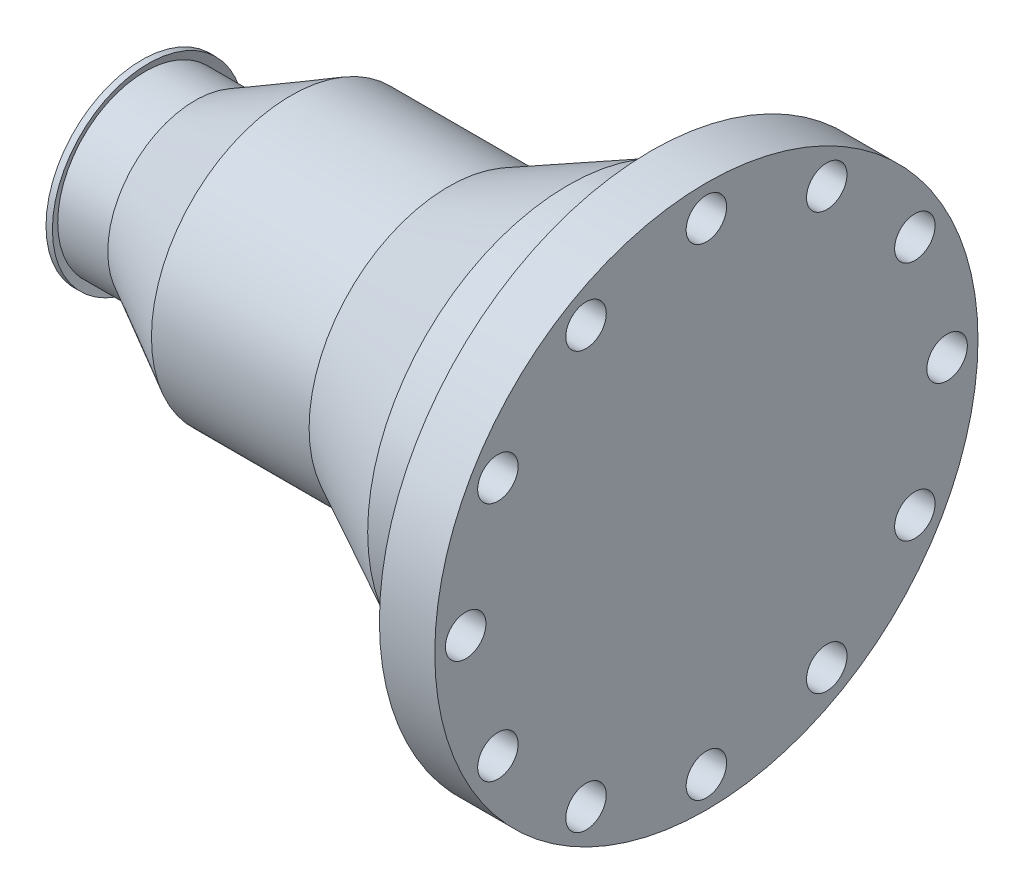
from build123d import *

# Parameters (mm, degrees)
SKETCH_3_R           = 9.5
CUT_EXTRUDE_1_DEPTH  = 321.526909947
SKETCH_4_R           = 9.5
CUT_EXTRUDE_2_DEPTH  = 321.526909947
SKETCH_5_R           = 9.5
CUT_EXTRUDE_3_DEPTH  = 321.526909947
SKETCH_6_R           = 9.5
CUT_EXTRUDE_4_DEPTH  = 321.526909947
SKETCH_7_R           = 9.5
CUT_EXTRUDE_5_DEPTH  = 321.526909947
SKETCH_8_R           = 9.5
CUT_EXTRUDE_6_DEPTH  = 321.526909947
SKETCH_9_R           = 9.5
CUT_EXTRUDE_7_DEPTH  = 321.526909947
SKETCH_10_R          = 9.5
CUT_EXTRUDE_8_DEPTH  = 321.526909947
SKETCH_11_R          = 9.5
CUT_EXTRUDE_9_DEPTH  = 321.526909947
SKETCH_12_R          = 9.5
CUT_EXTRUDE_10_DEPTH = 321.526909947
SKETCH_13_R          = 9.5
CUT_EXTRUDE_11_DEPTH = 321.526909947
SKETCH_14_R          = 9.5
CUT_EXTRUDE_12_DEPTH = 321.526909947


with BuildPart() as part:
    # Эскиз1 → Повернуть1 (revolve)
    with BuildSketch(Plane.XY, mode=Mode.PRIVATE) as revolve_1_sk:
        Polygon((0, 0), (265, 0), (265, 127.5), (239, 127.5), (239, 100), (239, 95), (220, 95), (220, 94), (200, 94), (144, 65.5), (70, 65.5), (25, 41), (1.5, 41), (3, 45), (0, 45), align=None)
    revolve(revolve_1_sk.sketch.rotate(Axis((0, 0, 0), (1, 0, 0)), 90), axis=Axis((0, 0, 0), (1, 0, 0)))

    # Эскиз2 → Вырез-Повернуть1 (revolve, cut)
    with BuildSketch(Plane.XY, mode=Mode.PRIVATE) as cut_revolve_1_sk:
        with BuildLine():
            Line((0, 0), (257, 0))
            Line((257, 0), (257, 34))
            Line((257, 34), (239, 34))
            Line((239, 34), (226, 47))
            Line((226, 47), (203.5, 47))
            Line((203.5, 47), (203.5, 55))
            Line((203.5, 55), (147.669872, 55))
            ThreePointArc((147.669872, 55), (146.273624348, 54.108499061), (146.669872, 52.5))
            Line((146.669872, 52.5), (143.5, 52.5))
            ThreePointArc((143.5, 52.5), (142.75, 52.602347572), (142, 52.5))
            Line((142, 52.5), (90, 52.5))
            ThreePointArc((90, 52.5), (79.13262933, 46.740617582), (70, 38.502577))
            Line((70, 38.502577), (42, 31))
            Line((42, 31), (0, 31))
            Line((0, 31), (0, 0))
        make_face()
    revolve(cut_revolve_1_sk.sketch.rotate(Axis((0, 0, 0), (1, 0, 0)), 90), axis=Axis((0, 0, 0), (1, 0, 0)), mode=Mode.SUBTRACT)

    # Эскиз3 → Вырез-Вытянуть1 (cut, through all)
    with BuildSketch(Plane(origin=(0, 0, 0), x_dir=(0, 0, -1), z_dir=(1, 0, 0))):
        with Locations((0, 113)):
            Circle(SKETCH_3_R)
    extrude(amount=CUT_EXTRUDE_1_DEPTH, mode=Mode.SUBTRACT)

    # Эскиз4 → Вырез-Вытянуть2 (cut, through all)
    with BuildSketch(Plane(origin=(0, 0, 0), x_dir=(0, 0, -1), z_dir=(1, 0, 0))):
        with Locations((-56.5, 97.860870628)):
            Circle(SKETCH_4_R)
    extrude(amount=CUT_EXTRUDE_2_DEPTH, mode=Mode.SUBTRACT)

    # Эскиз5 → Вырез-Вытянуть3 (cut, through all)
    with BuildSketch(Plane(origin=(0, 0, 0), x_dir=(0, 0, -1), z_dir=(1, 0, 0))):
        with Locations((-97.860870628, 56.5)):
            Circle(SKETCH_5_R)
    extrude(amount=CUT_EXTRUDE_3_DEPTH, mode=Mode.SUBTRACT)

    # Эскиз6 → Вырез-Вытянуть4 (cut, through all)
    with BuildSketch(Plane(origin=(0, 0, 0), x_dir=(0, 0, -1), z_dir=(1, 0, 0))):
        with Locations((-113, 0)):
            Circle(SKETCH_6_R)
    extrude(amount=CUT_EXTRUDE_4_DEPTH, mode=Mode.SUBTRACT)

    # Эскиз7 → Вырез-Вытянуть5 (cut, through all)
    with BuildSketch(Plane(origin=(0, 0, 0), x_dir=(0, 0, -1), z_dir=(1, 0, 0))):
        with Locations((-97.860870628, -56.5)):
            Circle(SKETCH_7_R)
    extrude(amount=CUT_EXTRUDE_5_DEPTH, mode=Mode.SUBTRACT)

    # Эскиз8 → Вырез-Вытянуть6 (cut, through all)
    with BuildSketch(Plane(origin=(0, 0, 0), x_dir=(0, 0, -1), z_dir=(1, 0, 0))):
        with Locations((-56.5, -97.860870628)):
            Circle(SKETCH_8_R)
    extrude(amount=CUT_EXTRUDE_6_DEPTH, mode=Mode.SUBTRACT)

    # Эскиз9 → Вырез-Вытянуть7 (cut, through all)
    with BuildSketch(Plane(origin=(0, 0, 0), x_dir=(0, 0, -1), z_dir=(1, 0, 0))):
        with Locations((0, -113)):
            Circle(SKETCH_9_R)
    extrude(amount=CUT_EXTRUDE_7_DEPTH, mode=Mode.SUBTRACT)

    # Эскиз10 → Вырез-Вытянуть8 (cut, through all)
    with BuildSketch(Plane(origin=(0, 0, 0), x_dir=(0, 0, -1), z_dir=(1, 0, 0))):
        with Locations((56.5, -97.860870628)):
            Circle(SKETCH_10_R)
    extrude(amount=CUT_EXTRUDE_8_DEPTH, mode=Mode.SUBTRACT)

    # Эскиз11 → Вырез-Вытянуть9 (cut, through all)
    with BuildSketch(Plane(origin=(0, 0, 0), x_dir=(0, 0, -1), z_dir=(1, 0, 0))):
        with Locations((97.860870628, -56.5)):
            Circle(SKETCH_11_R)
    extrude(amount=CUT_EXTRUDE_9_DEPTH, mode=Mode.SUBTRACT)

    # Эскиз12 → Вырез-Вытянуть10 (cut, through all)
    with BuildSketch(Plane(origin=(0, 0, 0), x_dir=(0, 0, -1), z_dir=(1, 0, 0))):
        with Locations((113, 0)):
            Circle(SKETCH_12_R)
    extrude(amount=CUT_EXTRUDE_10_DEPTH, mode=Mode.SUBTRACT)

    # Эскиз13 → Вырез-Вытянуть11 (cut, through all)
    with BuildSketch(Plane(origin=(0, 0, 0), x_dir=(0, 0, -1), z_dir=(1, 0, 0))):
        with Locations((97.860870628, 56.5)):
            Circle(SKETCH_13_R)
    extrude(amount=CUT_EXTRUDE_11_DEPTH, mode=Mode.SUBTRACT)

    # Эскиз14 → Вырез-Вытянуть12 (cut, through all)
    with BuildSketch(Plane(origin=(0, 0, 0), x_dir=(0, 0, -1), z_dir=(1, 0, 0))):
        with Locations((56.5, 97.860870628)):
            Circle(SKETCH_14_R)
    extrude(amount=CUT_EXTRUDE_12_DEPTH, mode=Mode.SUBTRACT)


solid = part.part
